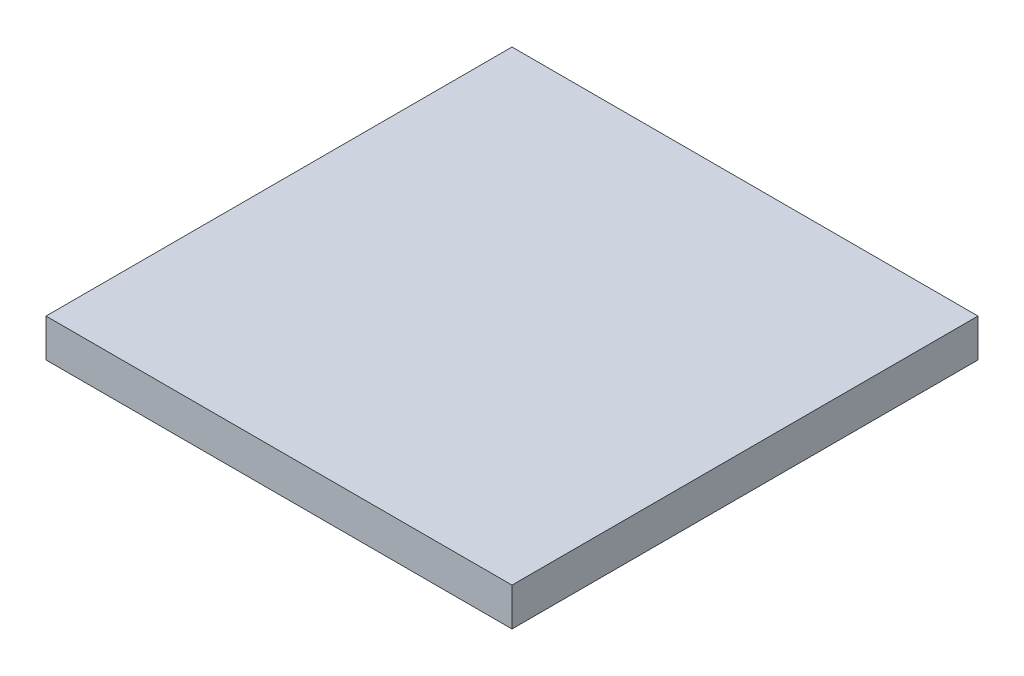
from build123d import *

# Parameters (mm, degrees)
SKETCH1_W           = 24.5
SKETCH1_H           = 24.5
BOSS_EXTRUDE1_DEPTH = 2


with BuildPart() as part:
    # Sketch1 → Boss-Extrude1 (new body)
    with BuildSketch(Plane(origin=(0, 0, 0), x_dir=(1, 0, 0), z_dir=(0, 1, 0))):
        with Locations((12.25, 12.25)):
            Rectangle(SKETCH1_W, SKETCH1_H)
    extrude(amount=BOSS_EXTRUDE1_DEPTH)


solid = part.part
